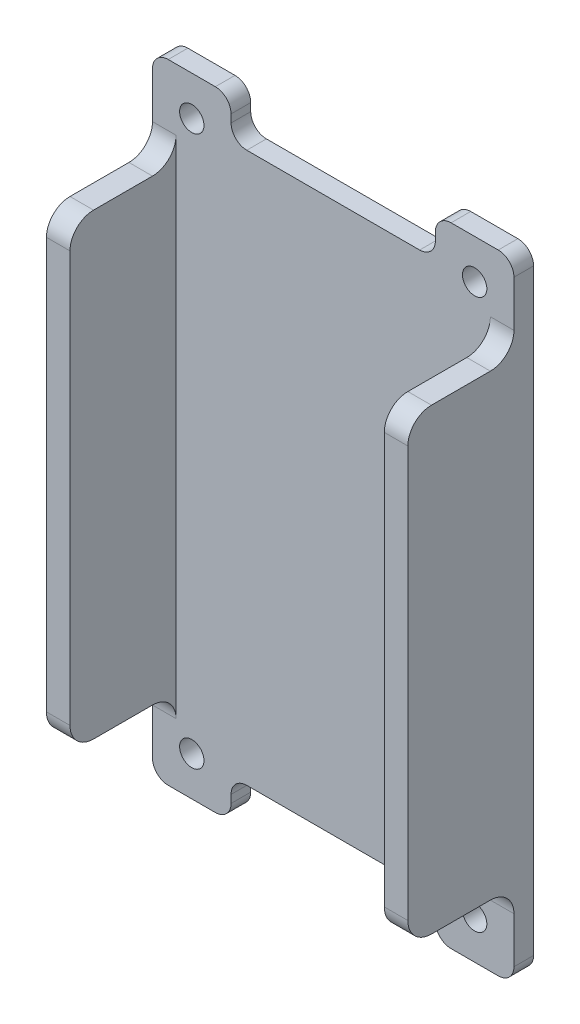
from build123d import *

# Parameters (mm, degrees)
SKETCH1_R           = 1.55
BOSS_EXTRUDE2_DEPTH = 2.5
SKETCH1_4_W         = 3
SKETCH1_4_H         = 58.3
BOSS_EXTRUDE3_DEPTH = 16
FILLET1_R           = 2
FILLET2_R           = 3


with BuildPart() as part:
    # Sketch1 → Boss-Extrude2 (new body)
    with BuildSketch(Plane.XY):
        Polygon((-23, -30), (-13, -30), (-13, -25), (13, -25), (13, -30), (23, -30), (23, 50), (13, 50), (13, 45), (-13, 45), (-13, 50), (-23, 50), align=None)
        with Locations((-18, 45)):
            Circle(SKETCH1_R, mode=Mode.SUBTRACT)
        with Locations((18, 45)):
            Circle(SKETCH1_R, mode=Mode.SUBTRACT)
        with Locations((18, -25)):
            Circle(SKETCH1_R, mode=Mode.SUBTRACT)
        with Locations((-18, -25)):
            Circle(SKETCH1_R, mode=Mode.SUBTRACT)
    extrude(amount=BOSS_EXTRUDE2_DEPTH)

    # Sketch1<4> → Boss-Extrude3 (add)
    with BuildSketch(Plane.XY):
        with Locations((-21.5, 10)):
            Rectangle(SKETCH1_4_W, SKETCH1_4_H)
        with Locations((21.5, 10)):
            Rectangle(SKETCH1_4_W, SKETCH1_4_H)
    extrude(amount=BOSS_EXTRUDE3_DEPTH)

    # Fillet1
    fillet1_edges = [part.edges().sort_by_distance(p)[0] for p in [
        (-23, -30, 1.25),
        (-13, -30, 1.25),
        (-13, -25, 1.25),
        (13, -25, 1.25),
        (13, -30, 1.25),
        (23, -30, 1.25),
        (13, 50, 1.25),
        (13, 45, 1.25),
        (-13, 45, 1.25),
        (-13, 50, 1.25),
        (-23, 50, 1.25),
        (23, 50, 1.25),
    ]]
    fillet(fillet1_edges, radius=FILLET1_R)

    # Fillet2
    fillet2_edges = [part.edges().sort_by_distance(p)[0] for p in [
        (-21.5, -19.15, 2.5),
        (-21.5, -19.15, 16),
        (-21.5, 39.15, 16),
        (-21.5, 39.15, 2.5),
        (21.5, -19.15, 16),
        (21.5, -19.15, 2.5),
        (21.5, 39.15, 16),
        (21.5, 39.15, 2.5),
    ]]
    fillet(fillet2_edges, radius=FILLET2_R)


solid = part.part
